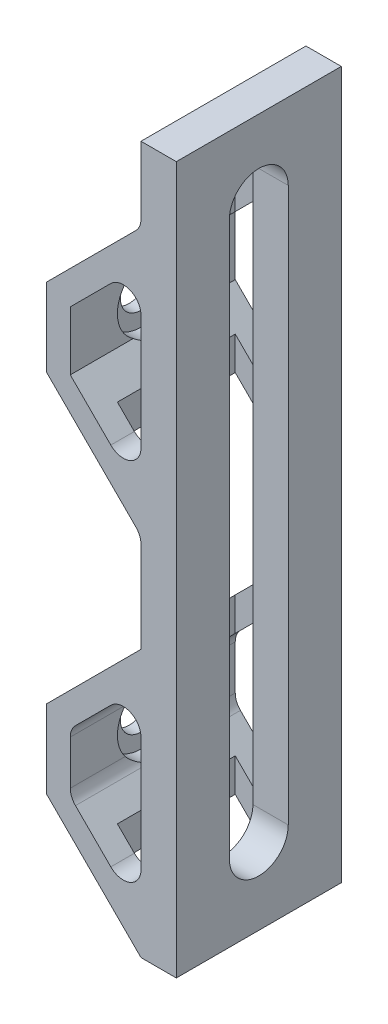
from build123d import *

# Parameters (mm, degrees)
SKETCH4_W           = 60
SKETCH4_H           = 14
BOSS_EXTRUDE2_DEPTH = 3
BOSS_EXTRUDE3_REACH = 63.685
SKETCH7_W           = 4
SKETCH7_H           = 10
CUT_EXTRUDE2_DEPTH  = 63.128898268
SKETCH8_R           = 1.75
CUT_EXTRUDE3_DEPTH  = 63.265560304
CUT_EXTRUDE4_START  = -1
SKETCH9_R           = 3
CUT_EXTRUDE4_DEPTH  = 1.5
FILLET1_R           = 1.5


with BuildPart() as part:
    # Sketch4 → Boss-Extrude2 (new body)
    with BuildSketch(Plane.YZ):
        with Locations((30, 7)):
            Rectangle(SKETCH4_W, SKETCH4_H)
        with BuildLine():
            Line((6.5, 9.5), (53.5, 9.5))
            ThreePointArc((53.5, 9.5), (56, 7), (53.5, 4.5))
            Line((53.5, 4.5), (6.5, 4.5))
            ThreePointArc((6.5, 4.5), (4, 7), (6.5, 9.5))
        make_face(mode=Mode.SUBTRACT)
    extrude(amount=BOSS_EXTRUDE2_DEPTH)

    # Boss-Extrude3: up to this face of the body (flat: up to its plane)
    boss_extrude3_end = Plane(part.part.faces().sort_by_distance((1.5, 30, 14))[0])
    # Sketch6 → Boss-Extrude3 (add, up to the picked face)
    with BuildSketch(Plane(origin=(0, 0, 0), x_dir=(1, 0, 0), z_dir=(0, 0, -1)), mode=Mode.PRIVATE) as boss_extrude3_sk1:
        Polygon((0, -2.828427125), (-6, -8.828427125), (-6, -13.828427125), (0, -19.828427125), (0, -22.656854249), (-8, -14.656854249), (-8, -8), (0, 0), align=None)
    boss_extrude3_tool1 = split(extrude(boss_extrude3_sk1.sketch, amount=-BOSS_EXTRUDE3_REACH, mode=Mode.PRIVATE), bisect_by=boss_extrude3_end, keep=Keep.BOTH, mode=Mode.PRIVATE)
    # Sketch6 → Boss-Extrude3 (add, up to the picked face)
    with BuildSketch(Plane(origin=(0, 0, 0), x_dir=(1, 0, 0), z_dir=(0, 0, -1)), mode=Mode.PRIVATE) as boss_extrude3_sk2:
        Polygon((0, -33.828427125), (-6, -39.828427125), (-6, -44.828427125), (0, -50.828427125), (0, -53.656854249), (-8, -45.656854249), (-8, -39), (0, -31), align=None)
    boss_extrude3_tool2 = split(extrude(boss_extrude3_sk2.sketch, amount=-BOSS_EXTRUDE3_REACH, mode=Mode.PRIVATE), bisect_by=boss_extrude3_end, keep=Keep.BOTH, mode=Mode.PRIVATE)
    add(boss_extrude3_tool1.solids().sort_by(Axis((-3.169902, 5.658525, 0), (0, 0, 1)))[0])
    add(boss_extrude3_tool2.solids().sort_by(Axis((-3.169902, 36.658525, 0), (0, 0, 1)))[0])

    # Sketch7 → Cut-Extrude2 (cut, through all)
    with BuildSketch(Plane(origin=(0, 60, 0), x_dir=(-1, 0, 0), z_dir=(0, 1, 0))):
        with Locations((2, 7)):
            Rectangle(SKETCH7_W, SKETCH7_H)
    extrude(amount=-CUT_EXTRUDE2_DEPTH, mode=Mode.SUBTRACT)

    # Sketch8 → Cut-Extrude3 (cut, through all)
    with BuildSketch(Plane.YZ.offset(-6)):
        with Locations((42.328427125, 7)):
            Circle(SKETCH8_R)
        with Locations((11.328427125, 7)):
            Circle(SKETCH8_R)
    extrude(amount=-CUT_EXTRUDE3_DEPTH, mode=Mode.SUBTRACT)

    # Sketch9 → Cut-Extrude4 (cut)
    with BuildSketch(Plane.YZ.offset(-6).offset(CUT_EXTRUDE4_START)):
        with Locations(Location((11.328427125, 7, 0), (0, 0, 270))):
            Circle(SKETCH9_R)
        with Locations(Location((42.328427125, 7, 0), (0, 0, 213.557309762))):
            Circle(SKETCH9_R)
    extrude(amount=CUT_EXTRUDE4_DEPTH, mode=Mode.SUBTRACT)

    # Fillet1
    fillet1_edges = [part.edges().sort_by_distance(p)[0] for p in [
        (0, 53.656854249, 1),
        (0, 53.656854249, 13),
        (0, 33.828427125, 13),
        (0, 50.828427125, 13),
        (0, 31, 13),
        (0, 50.828427125, 1),
        (0, 33.828427125, 1),
        (0, 2.828427125, 13),
        (0, 19.828427125, 13),
        (0, 19.828427125, 1),
        (0, 2.828427125, 1),
        (-6, 13.828427125, 11.329156198),
        (-6, 8.828427125, 11.329156198),
        (-6, 8.828427125, 2.670843802),
        (-6, 13.828427125, 2.670843802),
    ]]
    fillet(fillet1_edges, radius=FILLET1_R)


solid = part.part
